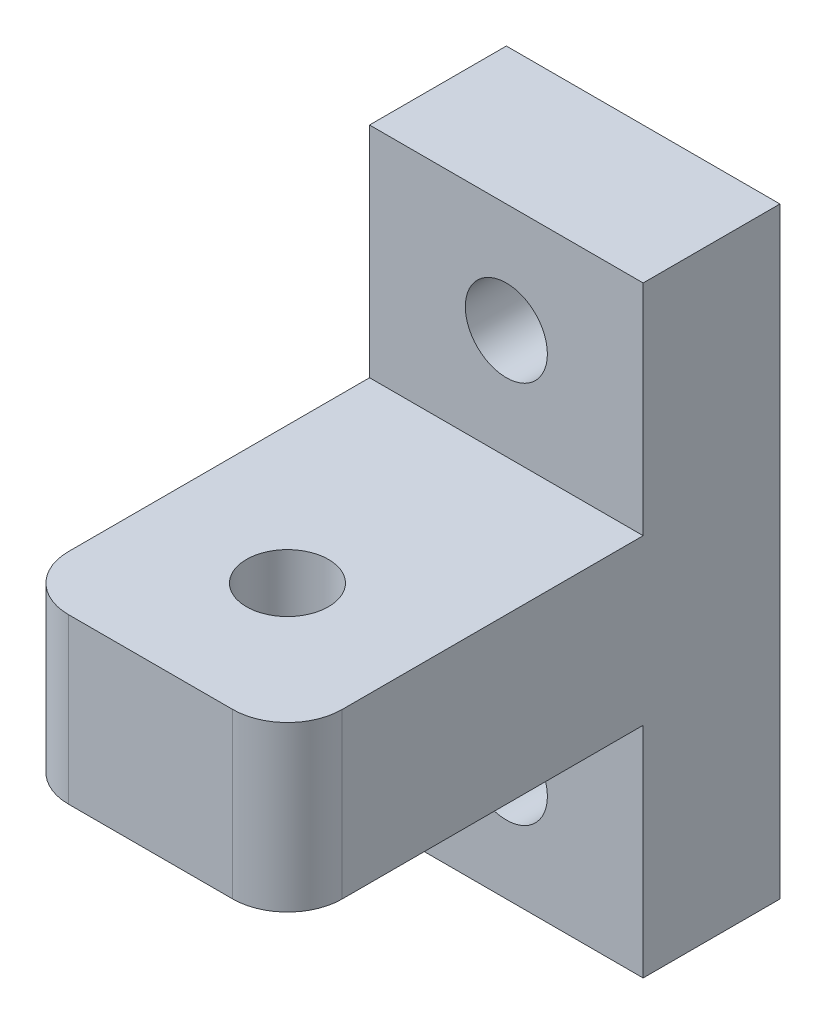
from build123d import *

# Parameters (mm, degrees)
CROQUIS1_W              = 10
CROQUIS1_H              = 22
SALIENTE_EXTRUIR1_DEPTH = 5
CROQUIS2_W              = 10
CROQUIS2_H              = 6
SALIENTE_EXTRUIR2_DEPTH = 13
REDONDEO1_R             = 2
CROQUIS3_R              = 1.5
CORTAR_EXTRUIR1_DEPTH   = 13
CROQUIS4_R              = 1.5
CORTAR_EXTRUIR2_DEPTH   = 13


with BuildPart() as part:
    # Croquis1 → Saliente-Extruir1 (new body)
    with BuildSketch(Plane.XY):
        Rectangle(CROQUIS1_W, CROQUIS1_H)
    extrude(amount=SALIENTE_EXTRUIR1_DEPTH)

    # Croquis2 → Saliente-Extruir2 (add)
    with BuildSketch(Plane.XY.offset(5)):
        Rectangle(CROQUIS2_W, CROQUIS2_H)
    extrude(amount=SALIENTE_EXTRUIR2_DEPTH)

    # Redondeo1
    redondeo1_edges = [part.edges().sort_by_distance(p)[0] for p in [
        (5, 0, 18),
        (-5, 0, 18),
    ]]
    fillet(redondeo1_edges, radius=REDONDEO1_R)

    # Croquis3 → Cortar-Extruir1 (cut)
    with BuildSketch(Plane.XZ.offset(3)):
        with Locations(Location((0, 13, 0), (0, 0, 270))):
            Circle(CROQUIS3_R)
    extrude(amount=-CORTAR_EXTRUIR1_DEPTH, mode=Mode.SUBTRACT)

    # Croquis4 → Cortar-Extruir2 (cut)
    with BuildSketch(Plane.XY.offset(5)):
        with Locations((0, -7)):
            Circle(CROQUIS4_R)
        with Locations((0, 7)):
            Circle(CROQUIS4_R)
    extrude(amount=-CORTAR_EXTRUIR2_DEPTH, mode=Mode.SUBTRACT)


solid = part.part
